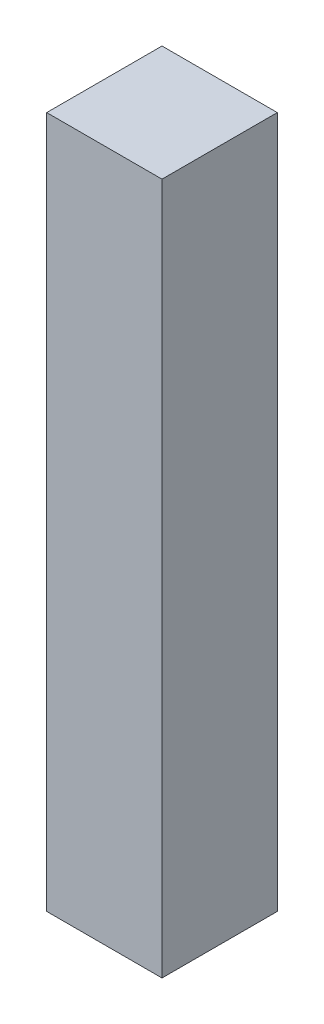
from build123d import *

# Parameters (mm, degrees)
SKETCH1_W           = 50.8
SKETCH1_H           = 50.8
BOSS_EXTRUDE1_DEPTH = 152.4


with BuildPart() as part:
    # Sketch1 → Boss-Extrude1 (new, symmetric)
    with BuildSketch(Plane(origin=(0, 0, 0), x_dir=(1, 0, 0), z_dir=(0, 1, 0))):
        Rectangle(SKETCH1_W, SKETCH1_H)
    extrude(amount=BOSS_EXTRUDE1_DEPTH, both=True)


solid = part.part
